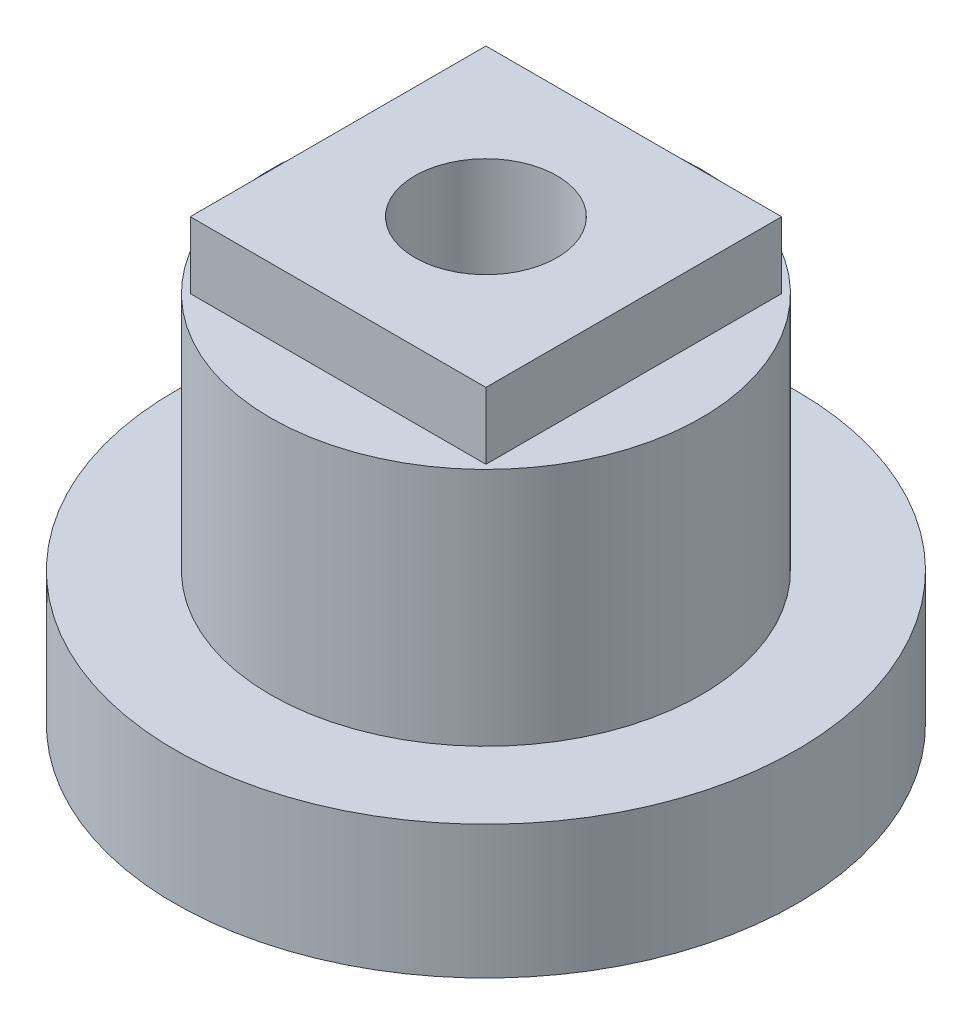
from build123d import *

# Parameters (mm, degrees)
CROQUIS2_W              = 6.658935778
CROQUIS2_H              = 6.658935778
CROQUIS2_R              = 1.6
SALIENTE_EXTRUIR1_DEPTH = 1.5
CORTAR_EXTRUIR1_DEPTH   = 1.5


with BuildPart() as part:
    # Croquis1 → Revolución1 (revolve)
    with BuildSketch(Plane.XY, mode=Mode.PRIVATE) as revoluci_n1_sk:
        Polygon((1.6, 0), (7, 0), (7, 3), (4.85, 3), (4.85, 8.4), (1.6, 8.4), align=None)
    revolve(revoluci_n1_sk.sketch.rotate(Axis((0, -1000, 0), (0, 1, 0)), 90), axis=Axis((0, -1000, 0), (0, 1, 0)))

    # Croquis2 → Saliente-Extruir1 (add)
    with BuildSketch(Plane(origin=(0, 8.4, 0), x_dir=(1, 0, 0), z_dir=(0, 1, 0))):
        Rectangle(CROQUIS2_W, CROQUIS2_H)
        with Locations(Location((0, 0, 0), (0, 0, 90))):
            Circle(CROQUIS2_R, mode=Mode.SUBTRACT)
    extrude(amount=SALIENTE_EXTRUIR1_DEPTH)

    # Croquis3 → Cortar-Extruir1 (cut)
    with BuildSketch(Plane(origin=(0, 0, 0), x_dir=(1, 0, 0), z_dir=(0, 1, 0))):
        Polygon((4.65, 0), (2.325, 4.027018128), (-2.325, 4.027018128), (-4.65, 0), (-2.325, -4.027018128), (2.325, -4.027018128), align=None)
    extrude(amount=CORTAR_EXTRUIR1_DEPTH, mode=Mode.SUBTRACT)


solid = part.part
